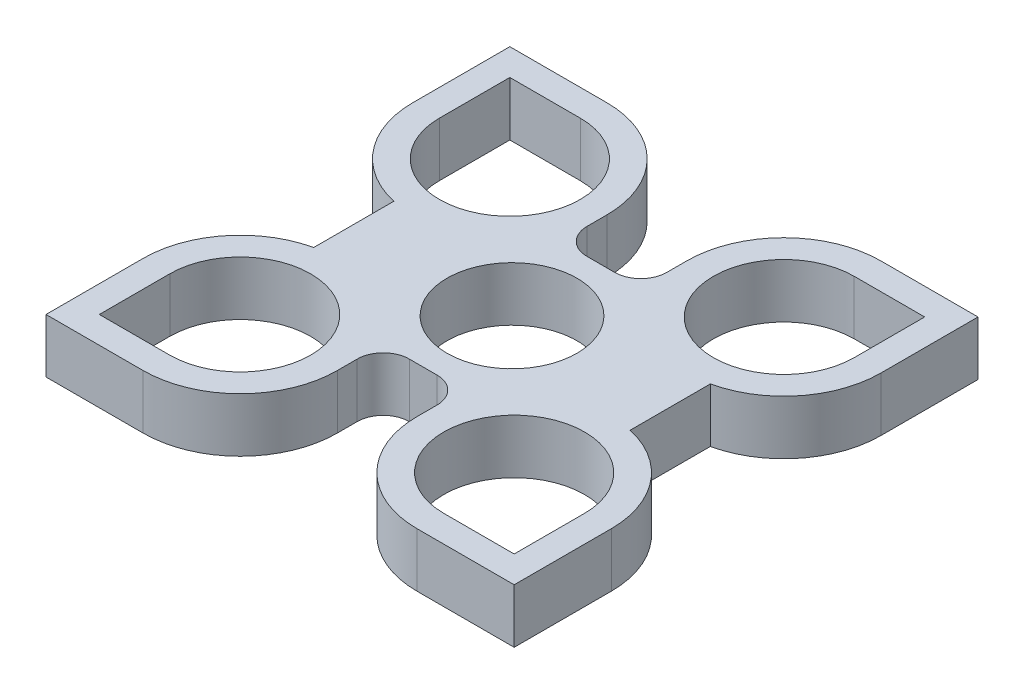
from build123d import *

# Parameters (mm, degrees)
SKETCH1_R           = 30
BOSS_EXTRUDE1_DEPTH = 25


with BuildPart() as part:
    # Sketch1 → Boss-Extrude1 (new body)
    with BuildSketch(Plane(origin=(0, 0, 0), x_dir=(1, 0, 0), z_dir=(0, 1, 0))):
        with BuildLine():
            Line((-108, 107), (-63.2, 107))
            ThreePointArc((-63.2, 107), (-31.521616203, 93.878383797), (-18.4, 62.2))
            Line((-18.4, 62.2), (-18.4, 53))
            ThreePointArc((-18.4, 53), (-14.885281374, 44.514718626), (-6.4, 41))
            Line((-6.4, 41), (0, 41))
            Line((0, 41), (6.4, 41))
            ThreePointArc((6.4, 41), (14.885281374, 44.514718626), (18.4, 53))
            Line((18.4, 53), (18.4, 62.2))
            ThreePointArc((18.4, 62.2), (31.521616203, 93.878383797), (63.2, 107))
            Line((63.2, 107), (108, 107))
            Line((108, 107), (108, 62.2))
            ThreePointArc((108, 62.2), (98.171988791, 34.2), (73, 18.485014011))
            Line((73, 18.485014011), (73, -18.485014011))
            ThreePointArc((73, -18.485014011), (98.171988791, -34.2), (108, -62.2))
            Line((108, -62.2), (108, -107))
            Line((108, -107), (63.2, -107))
            ThreePointArc((63.2, -107), (31.521616203, -93.878383797), (18.4, -62.2))
            Line((18.4, -62.2), (18.4, -53))
            ThreePointArc((18.4, -53), (14.885281374, -44.514718626), (6.4, -41))
            Line((6.4, -41), (0, -41))
            Line((0, -41), (-6.4, -41))
            ThreePointArc((-6.4, -41), (-14.885281374, -44.514718626), (-18.4, -53))
            Line((-18.4, -53), (-18.4, -62.2))
            ThreePointArc((-18.4, -62.2), (-31.521616203, -93.878383797), (-63.2, -107))
            Line((-63.2, -107), (-108, -107))
            Line((-108, -107), (-108, -62.2))
            ThreePointArc((-108, -62.2), (-98.171988791, -34.2), (-73, -18.485014011))
            Line((-73, -18.485014011), (-73, 18.485014011))
            ThreePointArc((-73, 18.485014011), (-98.171988791, 34.2), (-108, 62.2))
            Line((-108, 62.2), (-108, 107))
        make_face()
        with Locations(Location((0, 0, 0), (0, 0, 270))):
            Circle(SKETCH1_R, mode=Mode.SUBTRACT)
        with BuildLine():
            Line((-63.2, 94.7), (-95.7, 94.7))
            Line((-95.7, 94.7), (-95.7, 62.2))
            ThreePointArc((-95.7, 62.2), (-40.219029611, 39.219029611), (-63.2, 94.7))
        make_face(mode=Mode.SUBTRACT)
        with BuildLine():
            Line((-63.2, -94.7), (-95.7, -94.7))
            Line((-95.7, -94.7), (-95.7, -62.2))
            ThreePointArc((-95.7, -62.2), (-40.219029611, -39.219029611), (-63.2, -94.7))
        make_face(mode=Mode.SUBTRACT)
        with BuildLine():
            Line((63.2, -94.7), (95.7, -94.7))
            Line((95.7, -94.7), (95.7, -62.2))
            ThreePointArc((95.7, -62.2), (40.219029611, -39.219029611), (63.2, -94.7))
        make_face(mode=Mode.SUBTRACT)
        with BuildLine():
            Line((63.2, 94.7), (95.7, 94.7))
            Line((95.7, 94.7), (95.7, 62.2))
            ThreePointArc((95.7, 62.2), (40.219029611, 39.219029611), (63.2, 94.7))
        make_face(mode=Mode.SUBTRACT)
    extrude(amount=BOSS_EXTRUDE1_DEPTH)


solid = part.part
